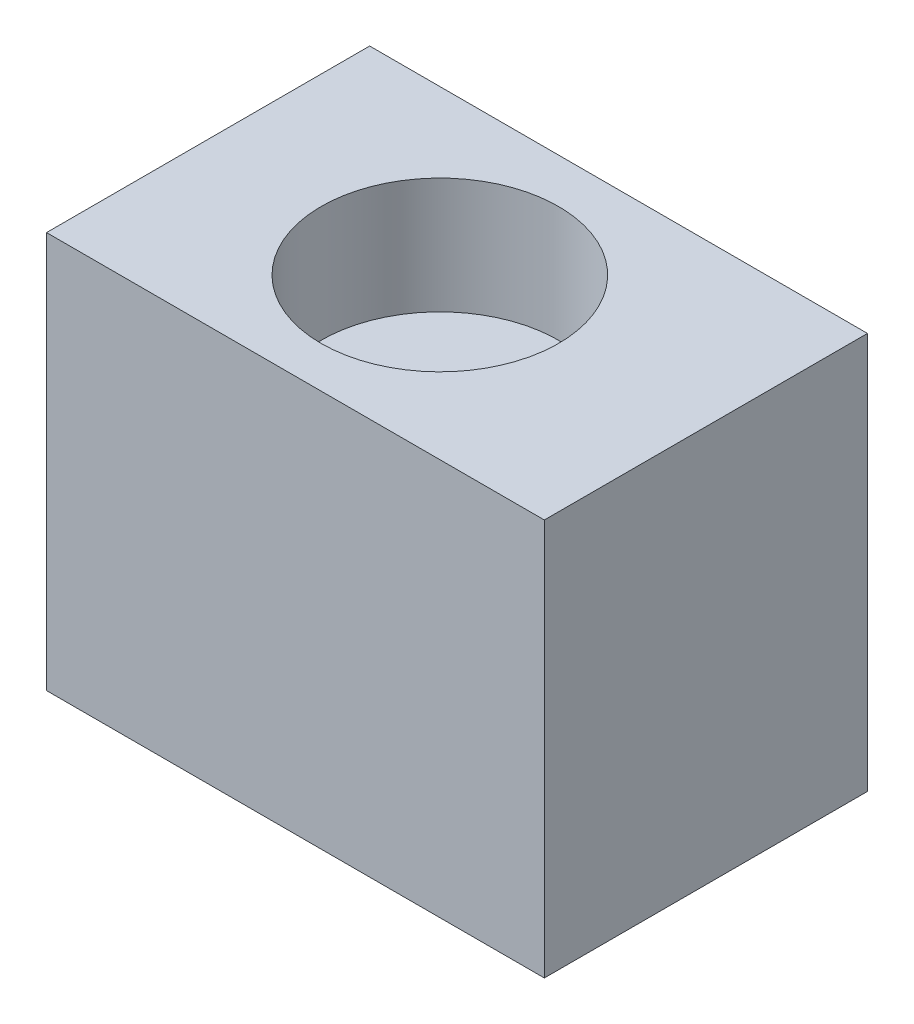
from build123d import *

# Parameters (mm, degrees)
ESQUISSE1_W             = 45.97
ESQUISSE1_H             = 36.63
BOSS_EXTRU_1_DEPTH      = 29.84
ESQUISSE2_R             = 10.96
ENL_V_MAT_EXTRU_1_DEPTH = 10.7


with BuildPart() as part:
    # Esquisse1 → Boss.-Extru.1 (new body)
    with BuildSketch(Plane.XY):
        with Locations((22.985, 18.315)):
            Rectangle(ESQUISSE1_W, ESQUISSE1_H)
    extrude(amount=BOSS_EXTRU_1_DEPTH)

    # Esquisse2 → Enlèv. mat.-Extru.1 (cut)
    with BuildSketch(Plane(origin=(0, 36.63, 0), x_dir=(1, 0, 0), z_dir=(0, 1, 0))):
        with Locations(Location((21.55, -15.07, 0), (0, 0, 270))):
            Circle(ESQUISSE2_R)
    extrude(amount=-ENL_V_MAT_EXTRU_1_DEPTH, mode=Mode.SUBTRACT)


solid = part.part
